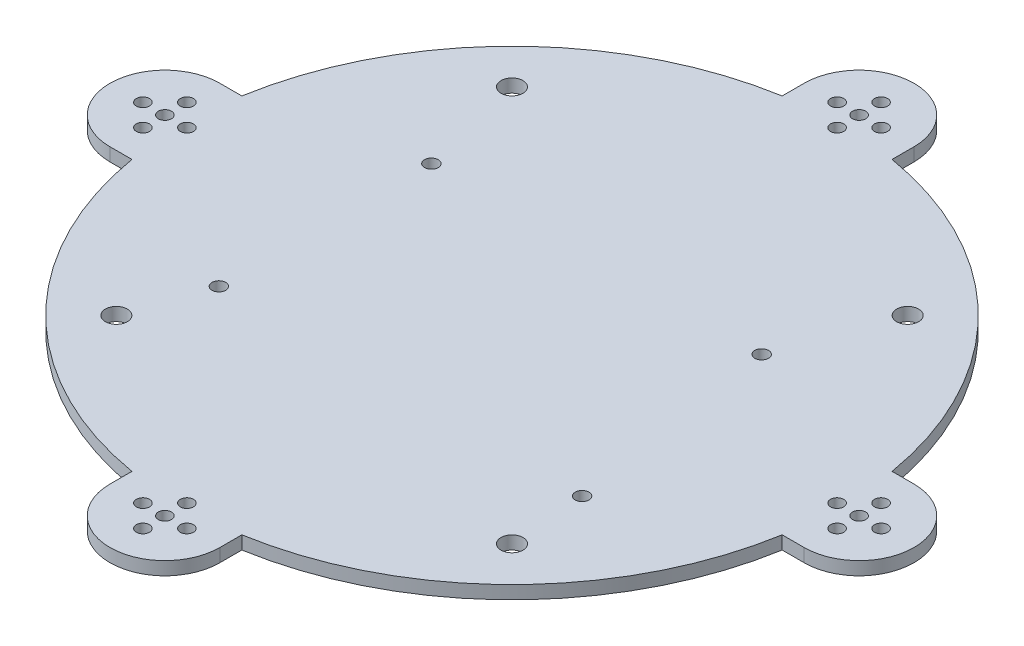
from build123d import *

# Parameters (mm, degrees)
IZIM1_R                     = 1.5
IZIM1_R_2                   = 1.5621
IZIM1_R_3                   = 2.5
Y_KSEKLIK_EKSTR_ZYON1_DEPTH = 3


with BuildPart() as part:
    # Çizim1 → Yükseklik-Ekstrüzyon1 (new body)
    with BuildSketch(Plane(origin=(0, 0, 0), x_dir=(1, 0, 0), z_dir=(0, 1, 0))):
        with BuildLine():
            Line((-78.950997289, 12.5), (-73.950997289, 12.5))
            ThreePointArc((-73.950997289, 12.5), (-53.033008589, 53.033008589), (-12.5, 73.950997289))
            Line((-12.5, 73.950997289), (-12.5, 78.950997289))
            ThreePointArc((-12.5, 78.950997289), (0, 91.450997289), (12.5, 78.950997289))
            Line((12.5, 78.950997289), (12.5, 73.950997289))
            ThreePointArc((12.5, 73.950997289), (53.033008589, 53.033008589), (73.950997289, 12.5))
            Line((73.950997289, 12.5), (78.950997289, 12.5))
            ThreePointArc((78.950997289, 12.5), (91.450997289, 0), (78.950997289, -12.5))
            Line((78.950997289, -12.5), (73.950997289, -12.5))
            ThreePointArc((73.950997289, -12.5), (53.033008589, -53.033008589), (12.5, -73.950997289))
            Line((12.5, -73.950997289), (12.5, -78.950997289))
            ThreePointArc((12.5, -78.950997289), (0, -91.450997289), (-12.5, -78.950997289))
            Line((-12.5, -78.950997289), (-12.5, -73.950997289))
            ThreePointArc((-12.5, -73.950997289), (-53.033008589, -53.033008589), (-73.950997289, -12.5))
            Line((-73.950997289, -12.5), (-78.950997289, -12.5))
            ThreePointArc((-78.950997289, -12.5), (-91.450997289, 0), (-78.950997289, 12.5))
        make_face()
        with Locations(Location((-78.950997289, 0, 0), (0, 0, 270))):
            Circle(IZIM1_R, mode=Mode.SUBTRACT)
        with Locations(Location((-78.950997289, 5, 0), (0, 0, 270))):
            Circle(IZIM1_R, mode=Mode.SUBTRACT)
        with Locations(Location((-83.950997289, 0, 0), (0, 0, 270))):
            Circle(IZIM1_R, mode=Mode.SUBTRACT)
        with Locations(Location((-73.950997289, 0, 0), (0, 0, 270))):
            Circle(IZIM1_R, mode=Mode.SUBTRACT)
        with Locations(Location((-78.950997289, -5, 0), (0, 0, 270))):
            Circle(IZIM1_R, mode=Mode.SUBTRACT)
        with Locations(Location((36.071585404, 20.719390461, 0), (0, 0, 270))):
            Circle(IZIM1_R_2, mode=Mode.SUBTRACT)
        with Locations(Location((43.564585404, -27.616809539, 0), (0, 0, 270))):
            Circle(IZIM1_R_2, mode=Mode.SUBTRACT)
        with Locations(Location((-39.061614596, -27.616809539, 0), (0, 0, 270))):
            Circle(IZIM1_R_2, mode=Mode.SUBTRACT)
        with Locations(Location((-39.061614596, 20.719390461, 0), (0, 0, 270))):
            Circle(IZIM1_R_2, mode=Mode.SUBTRACT)
        with Locations(Location((-5, 78.950997289, 0), (0, 0, 270))):
            Circle(IZIM1_R, mode=Mode.SUBTRACT)
        with Locations(Location((0, 78.950997289, 0), (0, 0, 270))):
            Circle(IZIM1_R, mode=Mode.SUBTRACT)
        with Locations(Location((0, 83.950997289, 0), (0, 0, 270))):
            Circle(IZIM1_R, mode=Mode.SUBTRACT)
        with Locations(Location((5, 78.950997289, 0), (0, 0, 270))):
            Circle(IZIM1_R, mode=Mode.SUBTRACT)
        with Locations(Location((0, 73.950997289, 0), (0, 0, 270))):
            Circle(IZIM1_R, mode=Mode.SUBTRACT)
        with Locations(Location((78.950997289, 5, 0), (0, 0, 270))):
            Circle(IZIM1_R, mode=Mode.SUBTRACT)
        with Locations(Location((78.950997289, 0, 0), (0, 0, 270))):
            Circle(IZIM1_R, mode=Mode.SUBTRACT)
        with Locations(Location((83.950997289, 0, 0), (0, 0, 270))):
            Circle(IZIM1_R, mode=Mode.SUBTRACT)
        with Locations(Location((78.950997289, -5, 0), (0, 0, 270))):
            Circle(IZIM1_R, mode=Mode.SUBTRACT)
        with Locations(Location((73.950997289, 0, 0), (0, 0, 270))):
            Circle(IZIM1_R, mode=Mode.SUBTRACT)
        with Locations(Location((5, -78.950997289, 0), (0, 0, 270))):
            Circle(IZIM1_R, mode=Mode.SUBTRACT)
        with Locations(Location((0, -78.950997289, 0), (0, 0, 270))):
            Circle(IZIM1_R, mode=Mode.SUBTRACT)
        with Locations(Location((0, -83.950997289, 0), (0, 0, 270))):
            Circle(IZIM1_R, mode=Mode.SUBTRACT)
        with Locations(Location((-5, -78.950997289, 0), (0, 0, 270))):
            Circle(IZIM1_R, mode=Mode.SUBTRACT)
        with Locations(Location((0, -73.950997289, 0), (0, 0, 270))):
            Circle(IZIM1_R, mode=Mode.SUBTRACT)
        with Locations(Location((45, 45, 0), (0, 0, 270))):
            Circle(IZIM1_R_3, mode=Mode.SUBTRACT)
        with Locations(Location((45, -45, 0), (0, 0, 270))):
            Circle(IZIM1_R_3, mode=Mode.SUBTRACT)
        with Locations(Location((-45, -45, 0), (0, 0, 270))):
            Circle(IZIM1_R_3, mode=Mode.SUBTRACT)
        with Locations(Location((-45, 45, 0), (0, 0, 270))):
            Circle(IZIM1_R_3, mode=Mode.SUBTRACT)
    extrude(amount=Y_KSEKLIK_EKSTR_ZYON1_DEPTH)


solid = part.part
